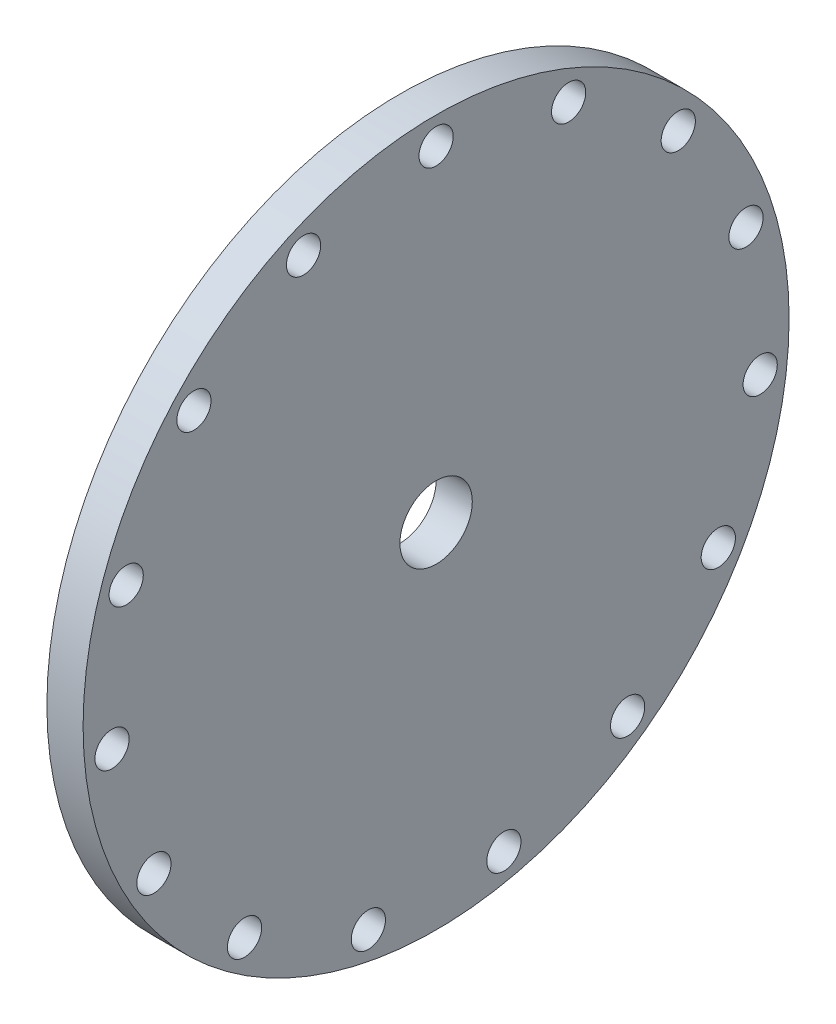
from build123d import *

# Parameters (mm, degrees)
SKETCH1_R           = 30.95625
SKETCH1_R_2         = 1.5
BOSS_EXTRUDE1_DEPTH = 3.175
SKETCH2_R           = 3.175
CUT_EXTRUDE1_DEPTH  = 44.893729087


with BuildPart() as part:
    # Sketch1 → Boss-Extrude1 (new body)
    with BuildSketch(Plane(origin=(0, 0, 0), x_dir=(0, 0, -1), z_dir=(1, 0, 0))):
        Circle(SKETCH1_R)
        with Locations((0, 28.575)):
            Circle(SKETCH1_R_2, mode=Mode.SUBTRACT)
        with Locations((11.622499576, 26.104561452)):
            Circle(SKETCH1_R_2, mode=Mode.SUBTRACT)
        with Locations((21.235363388, 19.120407077)):
            Circle(SKETCH1_R_2, mode=Mode.SUBTRACT)
        with Locations((27.176439953, 8.830160614)):
            Circle(SKETCH1_R_2, mode=Mode.SUBTRACT)
        with Locations((28.41846316, -2.986900838)):
            Circle(SKETCH1_R_2, mode=Mode.SUBTRACT)
        with Locations((24.746675913, -14.2875)):
            Circle(SKETCH1_R_2, mode=Mode.SUBTRACT)
        with Locations((16.795963584, -23.117660614)):
            Circle(SKETCH1_R_2, mode=Mode.SUBTRACT)
        with Locations((5.941076565, -27.950567691)):
            Circle(SKETCH1_R_2, mode=Mode.SUBTRACT)
        with Locations((-5.941076565, -27.950567691)):
            Circle(SKETCH1_R_2, mode=Mode.SUBTRACT)
        with Locations((-16.795963584, -23.117660614)):
            Circle(SKETCH1_R_2, mode=Mode.SUBTRACT)
        with Locations((-24.746675913, -14.2875)):
            Circle(SKETCH1_R_2, mode=Mode.SUBTRACT)
        with Locations((-28.41846316, -2.986900838)):
            Circle(SKETCH1_R_2, mode=Mode.SUBTRACT)
        with Locations((-27.176439953, 8.830160614)):
            Circle(SKETCH1_R_2, mode=Mode.SUBTRACT)
        with Locations((-21.235363388, 19.120407077)):
            Circle(SKETCH1_R_2, mode=Mode.SUBTRACT)
        with Locations((-11.622499576, 26.104561452)):
            Circle(SKETCH1_R_2, mode=Mode.SUBTRACT)
    extrude(amount=BOSS_EXTRUDE1_DEPTH)

    # Sketch2 → Cut-Extrude1 (cut, through all)
    with BuildSketch(Plane(origin=(3.175, 0, 0), x_dir=(0, 0, -1), z_dir=(1, 0, 0))):
        Circle(SKETCH2_R)
    extrude(amount=-CUT_EXTRUDE1_DEPTH, mode=Mode.SUBTRACT)


solid = part.part
